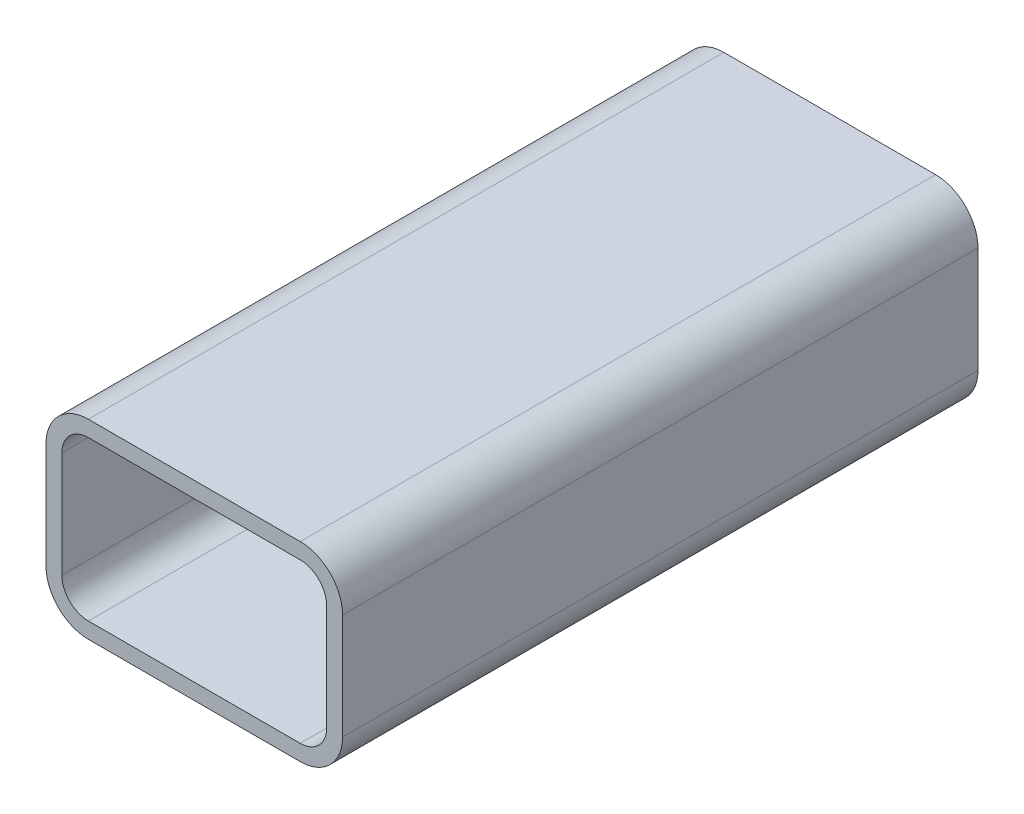
from build123d import *

# Parameters (mm, degrees)
EXTRUDE_THIN1_DEPTH = 60


with BuildPart() as part:
    # Sketch1 → Extrude-Thin1 (new, symmetric)
    with BuildSketch(Plane.XY):
        with BuildLine():
            Line((20, 18), (-20, 18))
            ThreePointArc((-20, 18), (-25.656854249, 15.656854249), (-28, 10))
            Line((-28, 10), (-28, -10))
            ThreePointArc((-28, -10), (-25.656854249, -15.656854249), (-20, -18))
            Line((-20, -18), (20, -18))
            ThreePointArc((20, -18), (25.656854249, -15.656854249), (28, -10))
            Line((28, -10), (28, 10))
            ThreePointArc((28, 10), (25.656854249, 15.656854249), (20, 18))
        make_face()
        with BuildLine():
            Line((20, 15), (-20, 15))
            ThreePointArc((-20, 15), (-23.535533906, 13.535533906), (-25, 10))
            Line((-25, 10), (-25, -10))
            ThreePointArc((-25, -10), (-23.535533906, -13.535533906), (-20, -15))
            Line((-20, -15), (20, -15))
            ThreePointArc((20, -15), (23.535533906, -13.535533906), (25, -10))
            Line((25, -10), (25, 10))
            ThreePointArc((25, 10), (23.535533906, 13.535533906), (20, 15))
        make_face(mode=Mode.SUBTRACT)
    extrude(amount=EXTRUDE_THIN1_DEPTH, both=True)


solid = part.part
